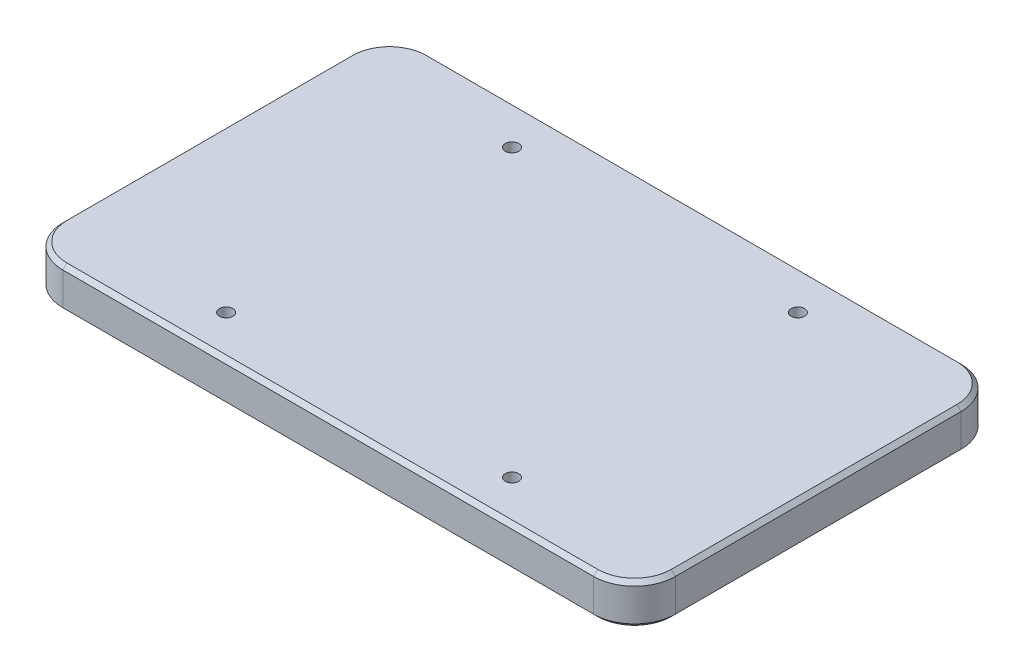
from build123d import *

# Parameters (mm, degrees)
SKETCH_1_W         = 150
SKETCH_1_H         = 90
EXTRUDE_1_DEPTH    = 10
FILLET_2_R         = 10
CHAMFER_1_SIZE     = 1
CHAMFER_2_SIZE     = 1
HOLE_WIZARD_M4_3_D = 3.3


with BuildPart() as part:
    # 草图1 → 凸台-拉伸1 (new body)
    with BuildSketch(Plane(origin=(0, 0, 0), x_dir=(1, 0, 0), z_dir=(0, 1, 0))):
        with Locations((75, -45)):
            Rectangle(SKETCH_1_W, SKETCH_1_H)
    extrude(amount=EXTRUDE_1_DEPTH)

    # 圆角2
    fillet_2_edges = [part.edges().sort_by_distance(p)[0] for p in [
        (0, 5, 0),
        (150, 5, 0),
        (150, 5, 90),
        (0, 5, 90),
    ]]
    fillet(fillet_2_edges, radius=FILLET_2_R)

    # 倒角1
    chamfer_1_edges = [part.edges().sort_by_distance(p)[0] for p in [
        (75, 0, 0),
        (0, 0, 45),
        (150, 0, 45),
        (75, 0, 90),
        (2.928932188, 0, 2.928932188),
        (2.928932188, 0, 87.071067812),
        (147.071067812, 0, 87.071067812),
        (147.071067812, 0, 2.928932188),
    ]]
    chamfer(chamfer_1_edges, length=CHAMFER_1_SIZE)

    # 倒角2
    chamfer_2_edges = [part.edges().sort_by_distance(p)[0] for p in [
        (75, 10, 0),
        (150, 10, 45),
        (0, 10, 45),
        (75, 10, 90),
        (2.928932188, 10, 2.928932188),
        (2.928932188, 10, 87.071067812),
        (147.071067812, 10, 87.071067812),
        (147.071067812, 10, 2.928932188),
    ]]
    chamfer(chamfer_2_edges, length=CHAMFER_2_SIZE)

    # M4 螺纹孔3 (through all)
    with Locations(Plane(origin=(40, 10, 10), x_dir=(0, 0, 1), z_dir=(0, 1, 0))):
        with Locations((0, 0), (0, 70), (70, 0), (70, 70)):
            Hole(HOLE_WIZARD_M4_3_D / 2)


solid = part.part
